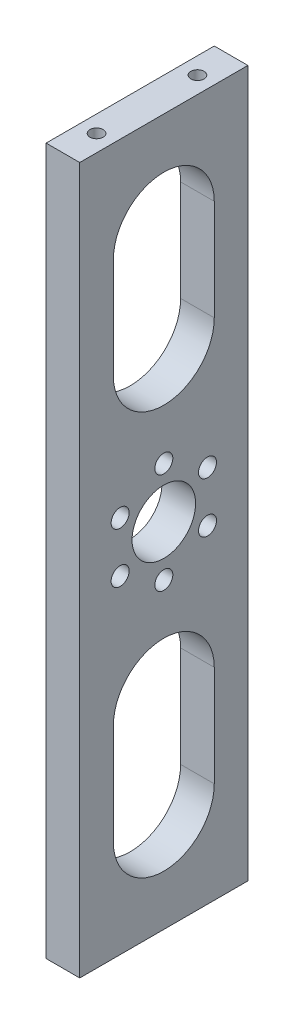
from build123d import *

# Parameters (mm, degrees)
SKETCH1_W                      = 31.75
SKETCH1_H                      = 133.35
BOSS_EXTRUDE1_DEPTH            = 3.175
M3X0_5_TAPPED_HOLE1_AT_2_COUNT = 2
M3X0_5_TAPPED_HOLE1_AT_2_PITCH = 19.05
F_12_0MM_DOWEL_HOLE1_D         = 12
CBORE_FOR_M3_SHCS1_D           = 3.4
CBORE_FOR_M3_SHCS1_DEPTH       = 11.678536948
CBORE_FOR_M3_SHCS1_CBORE_D     = 4.5
CBORE_FOR_M3_SHCS1_CBORE_DEPTH = 2
CBORE_FOR_M3_SHCS1_TIP         = 1.021463052
CUT_EXTRUDE1_DEPTH             = 69.832359759


with BuildPart() as part:
    # Sketch1 → Boss-Extrude1 (new, symmetric)
    with BuildSketch(Plane(origin=(0, 0, 0), x_dir=(0, 0, -1), z_dir=(1, 0, 0))):
        Rectangle(SKETCH1_W, SKETCH1_H)
    extrude(amount=BOSS_EXTRUDE1_DEPTH, both=True)

    # Sketch5 → M3x0.5 Tapped Hole1 (revolve, cut)
    with BuildSketch(Plane(origin=(0, 66.675, -9.525), x_dir=(0, 0, 1), z_dir=(1, 0, 0))):
        Polygon((0, 0), (0, 13.451075774), (1.25, 12.7), (1.25, 0), align=None)
    m3x0_5_tapped_hole1 = revolve(axis=Axis((0, 73.025, -9.525), (0, -1, 0)), mode=Mode.SUBTRACT)

    # M3x0.5 Tapped Hole1 at 2: M3x0.5 Tapped Hole1 ×2
    with Locations(*[(0, 0, i * M3X0_5_TAPPED_HOLE1_AT_2_PITCH) for i in range(1, M3X0_5_TAPPED_HOLE1_AT_2_COUNT)]):
        add(m3x0_5_tapped_hole1, mode=Mode.SUBTRACT)

    # Mirror1: M3x0.5 Tapped Hole1 across plane
    add(m3x0_5_tapped_hole1.mirror(Plane.ZX), mode=Mode.SUBTRACT)

    # Mirror1 copy 1 sketch → Mirror1 copy 1 (revolve, cut)
    with BuildSketch(Plane(origin=(0, -66.675, 9.525), x_dir=(0, 0, 1), z_dir=(1, 0, 0))):
        Polygon((0, 0), (0, -13.451075774), (1.25, -12.7), (1.25, 0), align=None)
    revolve(axis=Axis((0, -73.025, 9.525), (0, -1, 0)), mode=Mode.SUBTRACT)

    # Ø12.0mm Dowel Hole1 (through all)
    with Locations(Plane.ZY.offset(3.175)):
        with Locations((0, 0)):
            Hole(F_12_0MM_DOWEL_HOLE1_D / 2)

    # CBORE for M3 SHCS1
    with Locations(Plane.ZY.offset(3.175)):
        with Locations((8.248891971, -4.7625), (8.248891971, 4.7625), (0, 9.525), (-8.248891971, 4.7625), (-8.248891971, -4.7625), (0, -9.525)):
            CounterBoreHole(CBORE_FOR_M3_SHCS1_D / 2, CBORE_FOR_M3_SHCS1_CBORE_D / 2, CBORE_FOR_M3_SHCS1_CBORE_DEPTH, depth=CBORE_FOR_M3_SHCS1_DEPTH)
            with Locations((0, 0, -(CBORE_FOR_M3_SHCS1_DEPTH + CBORE_FOR_M3_SHCS1_TIP / 2))):  # 118° drill point
                Cone(0, CBORE_FOR_M3_SHCS1_D / 2, CBORE_FOR_M3_SHCS1_TIP, mode=Mode.SUBTRACT)

    # Sketch12 → Cut-Extrude1 (cut, through all)
    with BuildSketch(Plane(origin=(3.175, 0, 0), x_dir=(0, 0, -1), z_dir=(1, 0, 0))):
        with BuildLine():
            Line((-9.525, -28.575), (-9.525, -47.625))
            ThreePointArc((-9.525, -47.625), (0, -57.15), (9.525, -47.625))
            Line((9.525, -47.625), (9.525, -28.575))
            ThreePointArc((9.525, -28.575), (0, -19.05), (-9.525, -28.575))
        make_face()
        with BuildLine():
            Line((9.525, 47.625), (9.525, 28.575))
            ThreePointArc((9.525, 28.575), (0, 19.05), (-9.525, 28.575))
            Line((-9.525, 28.575), (-9.525, 47.625))
            ThreePointArc((-9.525, 47.625), (0, 57.15), (9.525, 47.625))
        make_face()
    extrude(amount=-CUT_EXTRUDE1_DEPTH, mode=Mode.SUBTRACT)


solid = part.part
